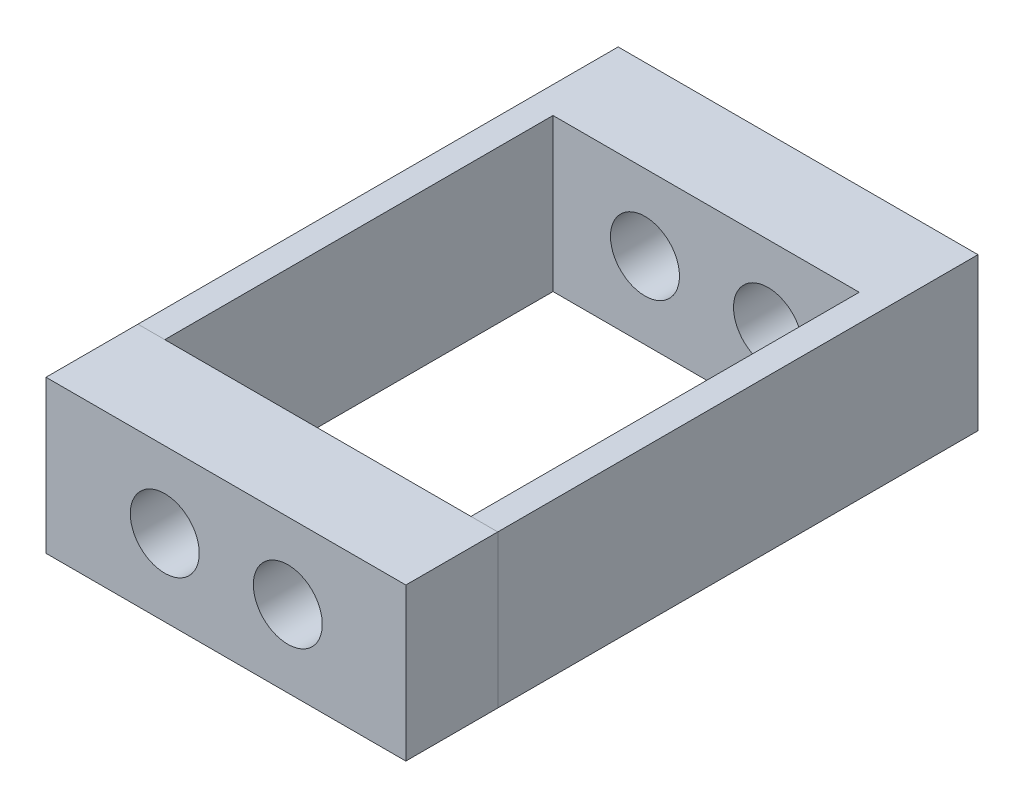
from build123d import *

# Parameters (mm, degrees)
BOSS_EXTRUDE1_START     = -31.75
SKETCH1_W               = 149.111686737
SKETCH1_H               = 237.0836
SKETCH1_W_2             = 126.886686737
SKETCH1_H_2             = 160.8836
BOSS_EXTRUDE1_DEPTH     = 63.196186737
CUT_EXTRUDE1_DEPTH      = 260.222960788
CUT_EXTRUDE1_DEPTH_BACK = 260.222960788
SKETCH2_R               = 14.2875


with BuildPart() as part:
    # Sketch1 → Boss-Extrude1 (new body)
    with BuildSketch(Plane(origin=(0, 0, 0), x_dir=(1, 0, 0), z_dir=(0, 1, 0)).offset(BOSS_EXTRUDE1_START)):
        with Locations((25.343343369, -179.324)):
            Rectangle(SKETCH1_W, SKETCH1_H)
        with Locations((25.343343369, -179.324)):
            Rectangle(SKETCH1_W_2, SKETCH1_H_2, mode=Mode.SUBTRACT)
    extrude(amount=BOSS_EXTRUDE1_DEPTH)

    # Sketch2 → Cut-Extrude1 (cut, two sides: drawn at the far end of the back side and taken through both)
    with BuildSketch(Plane.XY.offset(297.8658).offset(-CUT_EXTRUDE1_DEPTH_BACK)):
        with Locations(Location((0, 0, 0), (0, 0, 180))):
            Circle(SKETCH2_R)
        with Locations(Location((50.9905, 0, 0), (0, 0, 180))):
            Circle(SKETCH2_R)
    extrude(amount=CUT_EXTRUDE1_DEPTH + CUT_EXTRUDE1_DEPTH_BACK, mode=Mode.SUBTRACT)


with BuildPart() as body_2:
    # Split1: the piece on the far side of the plane
    add(part.part)
    split(bisect_by=Plane(origin=(0, 0, 259.7658), x_dir=(-1, 0, 0), z_dir=(0, 0, -1)), keep=Keep.BOTTOM)


with BuildPart() as part_1:
    add(part.part)

    # Split1
    split(bisect_by=Plane(origin=(0, 0, 259.7658), x_dir=(-1, 0, 0), z_dir=(0, 0, -1)), keep=Keep.TOP)


solid = Compound([body_2.part, part_1.part])
